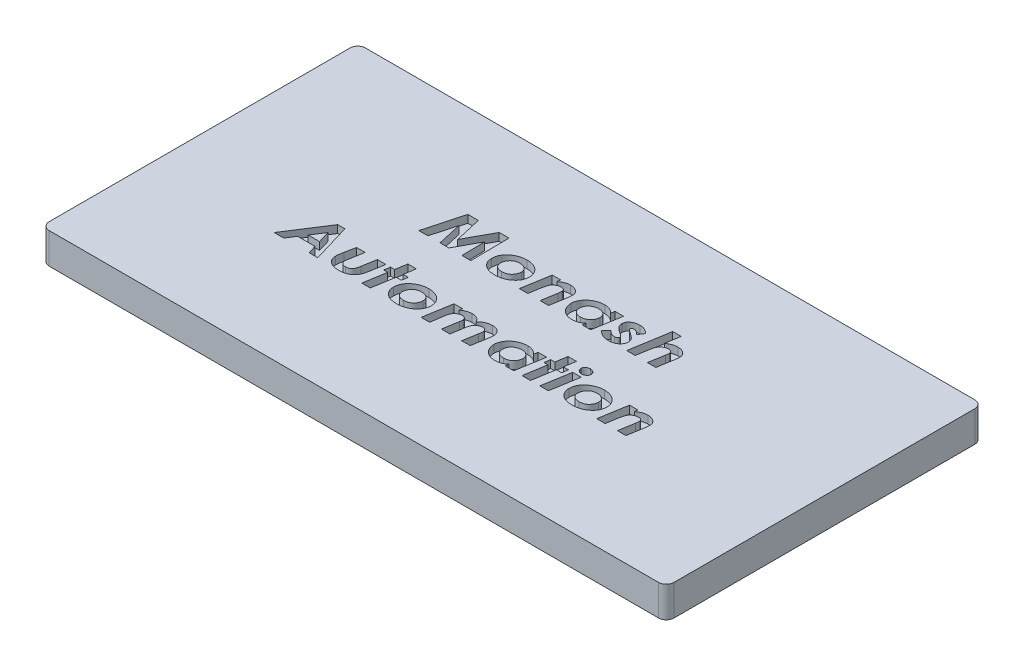
from build123d import *

# Parameters (mm, degrees)
BOSS_EXTRUDE4_DEPTH     = 4
SKETCH1_7_R             = 4.75
BOSS_EXTRUDE5_DEPTH     = 7
CUT_EXTRUDE2_DEPTH      = 47.706530593
CUT_EXTRUDE2_DEPTH_BACK = 1


with BuildPart() as part:
    # Sketch1 → Boss-Extrude4 (new body)
    with BuildSketch(Plane(origin=(0, 0, 0), x_dir=(1, 0, 0), z_dir=(0, 1, 0))):
        with BuildLine():
            Line((-39.5, 20.5), (39.5, 20.5))
            ThreePointArc((39.5, 20.5), (40.207106781, 20.207106781), (40.5, 19.5))
            Line((40.5, 19.5), (40.5, -19.5))
            ThreePointArc((40.5, -19.5), (40.207106781, -20.207106781), (39.5, -20.5))
            Line((39.5, -20.5), (-39.5, -20.5))
            ThreePointArc((-39.5, -20.5), (-40.207106781, -20.207106781), (-40.5, -19.5))
            Line((-40.5, -19.5), (-40.5, 19.5))
            ThreePointArc((-40.5, 19.5), (-40.207106781, 20.207106781), (-39.5, 20.5))
        make_face()
    extrude(amount=BOSS_EXTRUDE4_DEPTH)

    # Sketch1<7> → Boss-Extrude5 (add)
    with BuildSketch(Plane(origin=(0, 0, 0), x_dir=(1, 0, 0), z_dir=(0, 1, 0))):
        with Locations(Location((20, 0, 0), (0, 0, 270))):
            Circle(SKETCH1_7_R)
        with Locations(Location((-20, 0, 0), (0, 0, 270))):
            Circle(SKETCH1_7_R)
    extrude(amount=-BOSS_EXTRUDE5_DEPTH)

    # Sketch3 → Cut-Extrude2 (cut, two sides: drawn at the far end of the back side and taken through both)
    # profile 1 of 17: a face of its own
    with BuildSketch(Plane(origin=(0, 4, 0), x_dir=(1, 0, 0), z_dir=(0, 1, 0)).offset(-CUT_EXTRUDE2_DEPTH_BACK)):
        Polygon((-14.177109005, 8.458452894), (-12.817934325, 8.458452894), (-12.0266683, 4.974879176), (-10.123623428, 8.458452894), (-8.853591377, 8.458452894), (-8.789488813, 3.458452894), (-9.943334967, 3.458452894), (-10.007437531, 6.44923815), (-11.641051313, 3.458452894), (-12.786884646, 3.458452894), (-13.501027274, 6.599478535), (-14.359400672, 3.458452894), (-15.543294902, 3.458452894), align=None)
    # profile 2 of 17: a face of its own
    with BuildSketch(Plane(origin=(0, 4, 0), x_dir=(1, 0, 0), z_dir=(0, 1, 0)).offset(-CUT_EXTRUDE2_DEPTH_BACK)):
        with BuildLine():
            add(Edge.make_bspline(
                [(-5.205754838, 7.176401612), (-5.157986098, 7.176018128), (-5.063316945, 7.17525813), (-4.923322874, 7.16332593), (-4.78621551, 7.146636434), (-4.65271204, 7.122898828), (-4.522402446, 7.091372536), (-4.395528676, 7.053683234), (-4.271855087, 7.008314154), (-4.152139884, 6.956456877), (-4.036973296, 6.898493674), (-3.927571207, 6.83472), (-3.825514342, 6.763880535), (-3.728361564, 6.689618755), (-3.64064331, 6.606092236), (-3.557227843, 6.519583619), (-3.480298441, 6.426915495), (-3.411945471, 6.327821232), (-3.349774102, 6.224934599), (-3.295347966, 6.118713643), (-3.250119236, 6.008733288), (-3.213316888, 5.895819618), (-3.183938737, 5.779744274), (-3.162945244, 5.660942969), (-3.150726045, 5.538706369), (-3.149224505, 5.456343531), (-3.148463172, 5.414582702)],
                knots=[0, 0, 0, 0, 1.134040959, 2.247467629, 3.334150329, 4.413490396, 5.465399373, 6.516441462, 7.554877751, 8.591799532, 9.612991186, 10.61516897, 11.596012274, 12.561904645, 13.515581853, 14.468929422, 15.41506233, 16.371832588, 17.325015295, 18.268220228, 19.203191498, 20.145929778, 21.086264472, 22.044347893, 23.008416226, 24, 24, 24, 24], degree=3))
            add(Edge.make_bspline(
                [(-3.148463172, 5.414582702), (-3.150445347, 5.345662756), (-3.154357854, 5.209625428), (-3.189558634, 5.009806446), (-3.246942559, 4.818291916), (-3.326772942, 4.634259065), (-3.429801753, 4.458467621), (-3.554952303, 4.290109708), (-3.703398092, 4.130370092), (-3.872698846, 3.980903931), (-4.057683839, 3.843345635), (-4.255579612, 3.72243254), (-4.464907145, 3.62145495), (-4.68417098, 3.537550503), (-4.914702692, 3.473731032), (-5.155892025, 3.428015442), (-5.407706217, 3.39904262), (-5.579272891, 3.395931782), (-5.666492018, 3.39435033)],
                knots=[0, 0, 0, 0, 0.921708593, 1.819310388, 2.705598621, 3.592067026, 4.497077488, 5.426421462, 6.393915395, 7.409830938, 8.444621641, 9.475246663, 10.508347989, 11.550568148, 12.612935005, 13.704761146, 14.833172412, 16, 16, 16, 16], degree=3))
            add(Edge.make_bspline(
                [(-5.666492018, 3.39435033), (-5.742008556, 3.395515777), (-5.88937432, 3.397790074), (-6.104549371, 3.420766202), (-6.308099914, 3.455710132), (-6.499653519, 3.507313913), (-6.679671155, 3.572463457), (-6.848693218, 3.651070083), (-7.00519738, 3.746245581), (-7.148575933, 3.854914525), (-7.278445823, 3.974838416), (-7.390639018, 4.105676623), (-7.487548062, 4.24455362), (-7.564048705, 4.394066248), (-7.626311724, 4.551042103), (-7.669135772, 4.717578568), (-7.694315306, 4.892976397), (-7.697910435, 5.012856522), (-7.699745223, 5.07403783)],
                knots=[0, 0, 0, 0, 1.221687571, 2.384046269, 3.497990645, 4.560920458, 5.589868212, 6.592941434, 7.572395069, 8.548205602, 9.500149484, 10.427282185, 11.332508072, 12.233920424, 13.13895279, 14.060241795, 15.010036539, 16, 16, 16, 16], degree=3))
            add(Edge.make_bspline(
                [(-7.699745223, 5.07403783), (-7.697444506, 5.147968073), (-7.692910182, 5.293672096), (-7.656739335, 5.50706462), (-7.599063438, 5.711137909), (-7.51568764, 5.904828959), (-7.41003405, 6.089140329), (-7.280392606, 6.263704575), (-7.127257476, 6.428210274), (-6.95275739, 6.580986095), (-6.762996452, 6.719168589), (-6.564449138, 6.843199758), (-6.355797052, 6.944348821), (-6.141508121, 7.030836879), (-5.918200272, 7.095702095), (-5.687789405, 7.142688015), (-5.449214184, 7.171615688), (-5.287633452, 7.174792042), (-5.205754838, 7.176401612)],
                knots=[0, 0, 0, 0, 0.978943118, 1.929331537, 2.858896548, 3.782338015, 4.715536902, 5.667406287, 6.656439562, 7.687513275, 8.73496442, 9.763635104, 10.784334695, 11.802808489, 12.821714391, 13.86004861, 14.91561172, 16, 16, 16, 16], degree=3))
        make_face()
        with BuildLine():
            add(Edge.make_bspline(
                [(-5.287886249, 6.343068279), (-5.339692244, 6.341997786), (-5.440297355, 6.339918933), (-5.586804876, 6.321406899), (-5.724058353, 6.29178109), (-5.852502675, 6.250182324), (-5.970318986, 6.193801023), (-6.080679438, 6.128398545), (-6.180031122, 6.048137709), (-6.269578234, 5.958167556), (-6.349206942, 5.86151468), (-6.417958714, 5.761106711), (-6.478216695, 5.659648028), (-6.526050106, 5.555436556), (-6.563615253, 5.449144315), (-6.590582389, 5.341207412), (-6.607429066, 5.23081963), (-6.609139127, 5.156562928), (-6.610001633, 5.119109945)],
                knots=[0, 0, 0, 0, 1.235027415, 2.398372422, 3.515006561, 4.580035338, 5.609377971, 6.623926106, 7.632363676, 8.645755203, 9.646842525, 10.614179195, 11.545489814, 12.45747268, 13.343864026, 14.230219613, 15.107372783, 16, 16, 16, 16], degree=3))
            add(Edge.make_bspline(
                [(-6.610001633, 5.119109945), (-6.609343893, 5.086345414), (-6.608056425, 5.022211825), (-6.594690001, 4.928547108), (-6.572823003, 4.839829261), (-6.541530444, 4.756295459), (-6.501877917, 4.677675988), (-6.455418359, 4.602608018), (-6.396859748, 4.534841379), (-6.332580769, 4.470215304), (-6.259104475, 4.413993057), (-6.180848145, 4.363154212), (-6.096124249, 4.320994828), (-6.005332996, 4.28714736), (-5.909243235, 4.260001302), (-5.80734147, 4.241040319), (-5.699785353, 4.230114387), (-5.626119342, 4.228507275), (-5.588367018, 4.227683663)],
                knots=[0, 0, 0, 0, 1.029298631, 2.014758417, 2.966679621, 3.896477792, 4.81165136, 5.731625872, 6.662785172, 7.620070979, 8.592027595, 9.564324076, 10.549895611, 11.559533249, 12.606074263, 13.684591128, 14.813400324, 16, 16, 16, 16], degree=3))
            add(Edge.make_bspline(
                [(-5.588367018, 4.227683663), (-5.534903178, 4.228859997), (-5.431031548, 4.231145424), (-5.280163902, 4.24814814), (-5.139205633, 4.276874491), (-5.007923949, 4.318100059), (-4.886560808, 4.370956837), (-4.774922256, 4.435762404), (-4.673370936, 4.512085901), (-4.582408076, 4.599565168), (-4.50231183, 4.694303722), (-4.431212125, 4.792721526), (-4.372424009, 4.895485053), (-4.322435613, 5.000522987), (-4.285672409, 5.109686382), (-4.258562247, 5.221583678), (-4.240508874, 5.336875213), (-4.238978173, 5.415182868), (-4.238206761, 5.454646804)],
                knots=[0, 0, 0, 0, 1.253478669, 2.435307147, 3.554597822, 4.621750008, 5.655914285, 6.652227064, 7.641780917, 8.627393977, 9.60476431, 10.547599345, 11.470095912, 12.377216738, 13.270962539, 14.165291042, 15.07537985, 16, 16, 16, 16], degree=3))
            add(Edge.make_bspline(
                [(-4.238206761, 5.454646804), (-4.239327082, 5.486733321), (-4.241530242, 5.549832852), (-4.254183852, 5.642365678), (-4.277485415, 5.729985146), (-4.309839804, 5.812932868), (-4.351008825, 5.891296721), (-4.401327754, 5.96530968), (-4.462347932, 6.033055948), (-4.530102282, 6.097463009), (-4.605788939, 6.155031575), (-4.687587905, 6.205074693), (-4.773837012, 6.249062701), (-4.866696862, 6.28239362), (-4.964422678, 6.309624253), (-5.06747924, 6.329942835), (-5.176150582, 6.340528276), (-5.25013893, 6.342210197), (-5.287886249, 6.343068279)],
                knots=[0, 0, 0, 0, 0.998761082, 1.964107071, 2.899062725, 3.813590567, 4.72912115, 5.648416942, 6.590618194, 7.560816179, 8.55410426, 9.543090367, 10.542067585, 11.561103902, 12.607216108, 13.697340511, 14.825230961, 16, 16, 16, 16], degree=3))
        make_face(mode=Mode.SUBTRACT)
    # profile 3 of 17: a face of its own
    with BuildSketch(Plane(origin=(0, 4, 0), x_dir=(1, 0, 0), z_dir=(0, 1, 0)).offset(-CUT_EXTRUDE2_DEPTH_BACK)):
        with BuildLine():
            Line((-1.894456761, 7.112299048), (-0.792693941, 7.112299048))
            Line((-0.792693941, 7.112299048), (-0.861804518, 6.697635586))
            add(Edge.make_bspline(
                [(-0.861804518, 6.697635586), (-0.810914897, 6.735775658), (-0.711158973, 6.810539392), (-0.555126432, 6.908084263), (-0.3974738, 6.990175435), (-0.2392552, 7.059161655), (-0.078886859, 7.111617768), (0.083102954, 7.148298546), (0.24655151, 7.172880146), (0.356390558, 7.175228898), (0.411232341, 7.176401612)],
                knots=[0, 0, 0, 0, 1.100972132, 2.158170771, 3.182266255, 4.17680162, 5.144021205, 6.099154961, 7.050922844, 8, 8, 8, 8], degree=3))
            add(Edge.make_bspline(
                [(0.411232341, 7.176401612), (0.457331102, 7.175296385), (0.54737639, 7.173137531), (0.679429215, 7.160461934), (0.804949332, 7.137174693), (0.924354668, 7.105462228), (1.037235354, 7.064041704), (1.144224798, 7.01408093), (1.244059168, 6.953644793), (1.337304698, 6.886030803), (1.420994922, 6.810742656), (1.496069998, 6.731453233), (1.556861432, 6.644879959), (1.609302511, 6.555773348), (1.647796879, 6.460316049), (1.677942096, 6.361017893), (1.693295051, 6.256067746), (1.695946185, 6.18485488), (1.697290033, 6.148757381)],
                knots=[0, 0, 0, 0, 1.203755481, 2.35131072, 3.459245913, 4.533437425, 5.573119259, 6.594774717, 7.611359893, 8.615649263, 9.597286602, 10.547255557, 11.459270681, 12.353447624, 13.240585878, 14.139847265, 15.057096497, 16, 16, 16, 16], degree=3))
            add(Edge.make_bspline(
                [(1.697290033, 6.148757381), (1.696434642, 6.109666844), (1.694537351, 6.022962507), (1.67966314, 5.880078221), (1.659236165, 5.711307788), (1.63966227, 5.590467041), (1.629181059, 5.525760586)],
                knots=[0, 0, 0, 0, 0.747720737, 1.658473791, 2.74618569, 4, 4, 4, 4], degree=3))
            Line((1.629181059, 5.525760586), (1.28563138, 3.458452894))
            Line((1.28563138, 3.458452894), (0.184870162, 3.458452894))
            Line((0.184870162, 3.458452894), (0.519405418, 5.469670843))
            add(Edge.make_bspline(
                [(0.519405418, 5.469670843), (0.526688056, 5.51537277), (0.540272937, 5.600624185), (0.555199824, 5.719532429), (0.56523155, 5.820063129), (0.566784123, 5.880978233), (0.567482341, 5.908372766)],
                knots=[0, 0, 0, 0, 1.257141772, 2.345045846, 3.255739651, 4, 4, 4, 4], degree=3))
            add(Edge.make_bspline(
                [(0.567482341, 5.908372766), (0.565968507, 5.941300535), (0.563048787, 6.00480804), (0.534457295, 6.094241543), (0.485712839, 6.170678462), (0.418833263, 6.233940444), (0.334911524, 6.282731103), (0.236119307, 6.319168671), (0.121257053, 6.339558892), (0.039718678, 6.341853814), (-0.00343112, 6.343068279)],
                knots=[0, 0, 0, 0, 0.971478636, 1.873682499, 2.739059557, 3.625793431, 4.568767778, 5.590122915, 6.724702201, 8, 8, 8, 8], degree=3))
            add(Edge.make_bspline(
                [(-0.00343112, 6.343068279), (-0.04796374, 6.340938443), (-0.137550385, 6.336653834), (-0.272082814, 6.307676429), (-0.405279341, 6.257230598), (-0.537235559, 6.191181474), (-0.662270638, 6.108426448), (-0.772077197, 6.006832541), (-0.867184769, 5.891387992), (-0.934835586, 5.78231228), (-0.980331279, 5.681329259), (-1.016019399, 5.590795249), (-1.047911971, 5.484198197), (-1.080745378, 5.363256094), (-1.114483967, 5.227604704), (-1.144260162, 5.076567845), (-1.176101612, 4.910819923), (-1.194661231, 4.794982131), (-1.204352595, 4.734494561)],
                knots=[0, 0, 0, 0, 0.962270266, 1.935807175, 2.958420076, 4.032860869, 5.119417579, 6.186639856, 7.252666502, 8.344027149, 8.947699573, 9.644399427, 10.445366684, 11.35023558, 12.352904176, 13.465052712, 14.676314517, 16, 16, 16, 16], degree=3))
            Line((-1.204352595, 4.734494561), (-1.406676313, 3.458452894))
            Line((-1.406676313, 3.458452894), (-2.507437531, 3.458452894))
            Line((-2.507437531, 3.458452894), (-1.894456761, 7.112299048))
        make_face()
    # profile 4 of 17: a face of its own
    with BuildSketch(Plane(origin=(0, 4, 0), x_dir=(1, 0, 0), z_dir=(0, 1, 0)).offset(-CUT_EXTRUDE2_DEPTH_BACK)):
        with BuildLine():
            Line((6.24656888, 7.112299048), (7.347330098, 7.112299048))
            Line((7.347330098, 7.112299048), (6.734349328, 3.458452894))
            Line((6.734349328, 3.458452894), (5.63358811, 3.458452894))
            Line((5.63358811, 3.458452894), (5.7077067, 3.89815642))
            add(Edge.make_bspline(
                [(5.7077067, 3.89815642), (5.65126365, 3.853860524), (5.543002633, 3.768898449), (5.376433581, 3.660506777), (5.216818703, 3.571044637), (5.05914233, 3.503667241), (4.900279794, 3.452900054), (4.734234184, 3.420045411), (4.559457865, 3.398035556), (4.439749042, 3.395596593), (4.378580098, 3.39435033)],
                knots=[0, 0, 0, 0, 1.1838372, 2.27066783, 3.277037016, 4.200426999, 5.096336613, 6.024794754, 6.990707463, 8, 8, 8, 8], degree=3))
            add(Edge.make_bspline(
                [(4.378580098, 3.39435033), (4.308388442, 3.395735805), (4.170876188, 3.398450085), (3.970438123, 3.424151534), (3.780934865, 3.4649247), (3.60219393, 3.522082736), (3.434618383, 3.596249107), (3.277854103, 3.686942135), (3.133092597, 3.794913173), (3.000599595, 3.917589129), (2.882758935, 4.051614176), (2.777137387, 4.190545024), (2.690289576, 4.33697697), (2.617050985, 4.487260271), (2.562066287, 4.644094473), (2.521859859, 4.805646644), (2.497058844, 4.972778468), (2.49407143, 5.085973103), (2.492562469, 5.143148407)],
                knots=[0, 0, 0, 0, 1.171538007, 2.295156476, 3.367835321, 4.404461368, 5.422742617, 6.421922657, 7.422035349, 8.431935036, 9.430990657, 10.398760737, 11.341430634, 12.26897908, 13.185844971, 14.110658741, 15.045682155, 16, 16, 16, 16], degree=3))
            add(Edge.make_bspline(
                [(2.492562469, 5.143148407), (2.493530914, 5.187259215), (2.495458771, 5.275069378), (2.510853726, 5.406104413), (2.536941627, 5.535336866), (2.573637874, 5.662943183), (2.618233283, 5.789594994), (2.674626167, 5.914188565), (2.74259817, 6.036226706), (2.817966567, 6.157210241), (2.902718109, 6.273615216), (2.995268042, 6.384517217), (3.095391017, 6.488179128), (3.201741689, 6.58597738), (3.315598745, 6.676102023), (3.435682549, 6.760582524), (3.563546553, 6.837497941), (3.697014439, 6.908676383), (3.835611912, 6.970802066), (3.975731479, 7.026421088), (4.117978907, 7.072599151), (4.261387757, 7.110597779), (4.406917995, 7.139853542), (4.553737192, 7.160532062), (4.70216684, 7.17437505), (4.801559426, 7.17572536), (4.851336508, 7.176401612)],
                knots=[0, 0, 0, 0, 0.921899727, 1.835200247, 2.753606313, 3.674871814, 4.608635674, 5.55820152, 6.529598735, 7.526826541, 8.536118856, 9.536930185, 10.543855024, 11.546635474, 12.554841374, 13.577128273, 14.61365733, 15.672018767, 16.737101047, 17.786867546, 18.821962382, 19.861353942, 20.886519355, 21.922860431, 22.959741861, 24, 24, 24, 24], degree=3))
            add(Edge.make_bspline(
                [(4.851336508, 7.176401612), (4.917551737, 7.174830985), (5.047926841, 7.171738486), (5.239130217, 7.142454756), (5.422694864, 7.096956123), (5.596741832, 7.031441205), (5.760533264, 6.950215711), (5.90975425, 6.849712663), (6.045996923, 6.734046003), (6.122245818, 6.643047257), (6.160431059, 6.59747533)],
                knots=[0, 0, 0, 0, 1.071895657, 2.110519144, 3.125731938, 4.13024358, 5.117012808, 6.079961198, 7.038449743, 8, 8, 8, 8], degree=3))
            Line((6.160431059, 6.59747533), (6.24656888, 7.112299048))
        make_face()
        with BuildLine():
            add(Edge.make_bspline(
                [(4.627979136, 4.227683663), (4.689852745, 4.229291103), (4.810217793, 4.232418116), (4.984223404, 4.260155803), (5.146152132, 4.303899046), (5.296428594, 4.365978154), (5.433809313, 4.449536212), (5.560714439, 4.551710666), (5.675130858, 4.675169982), (5.775650417, 4.815716017), (5.85900822, 4.966952128), (5.921302617, 5.123061918), (5.958977805, 5.281923154), (5.963752423, 5.388683436), (5.966120162, 5.441625971)],
                knots=[0, 0, 0, 0, 1.106510134, 2.152535616, 3.143871394, 4.102481724, 5.051212295, 6.011273515, 7.008782323, 8.053271313, 9.095999097, 10.091107847, 11.053378391, 12, 12, 12, 12], degree=3))
            add(Edge.make_bspline(
                [(5.966120162, 5.441625971), (5.965002845, 5.474710502), (5.962815907, 5.53946725), (5.950242431, 5.634368634), (5.926506507, 5.723683532), (5.89603294, 5.808906498), (5.853983286, 5.88841115), (5.80428188, 5.963787985), (5.744356095, 6.033373893), (5.676186626, 6.097003625), (5.60133169, 6.155666361), (5.518660809, 6.205019193), (5.431725674, 6.248828924), (5.338075407, 6.282778472), (5.238861693, 6.309555858), (5.133835068, 6.329957131), (5.022830066, 6.340555686), (4.947176224, 6.342217256), (4.908427854, 6.343068279)],
                knots=[0, 0, 0, 0, 1.016096246, 1.988817321, 2.931086143, 3.848895347, 4.761250409, 5.685221007, 6.615820415, 7.573024866, 8.544881396, 9.52935962, 10.52413679, 11.529525498, 12.581392067, 13.67704895, 14.810231397, 16, 16, 16, 16], degree=3))
            add(Edge.make_bspline(
                [(4.908427854, 6.343068279), (4.862966637, 6.342250941), (4.773751512, 6.340646961), (4.642829905, 6.323726755), (4.516948808, 6.298275715), (4.396449007, 6.260700336), (4.280494753, 6.213775025), (4.170308265, 6.155413828), (4.065249489, 6.086819235), (3.967053719, 6.008287204), (3.876968396, 5.921871979), (3.798547995, 5.827872681), (3.730284282, 5.728646992), (3.676672655, 5.621791144), (3.633770358, 5.5094816), (3.604271962, 5.391098007), (3.585498209, 5.266611084), (3.583386234, 5.181612935), (3.582306059, 5.138140394)],
                knots=[0, 0, 0, 0, 1.088862099, 2.136831698, 3.158353851, 4.163068518, 5.157053707, 6.152004462, 7.14618284, 8.159557222, 9.161081095, 10.132230973, 11.088668878, 12.040477371, 12.99003011, 13.964174578, 14.958771402, 16, 16, 16, 16], degree=3))
            add(Edge.make_bspline(
                [(3.582306059, 5.138140394), (3.583415355, 5.104719171), (3.585586976, 5.039291876), (3.59827823, 4.943441672), (3.621613429, 4.852854237), (3.653685911, 4.767117922), (3.69509701, 4.686521756), (3.74538513, 4.610519566), (3.806143592, 4.540828042), (3.873868048, 4.475233747), (3.950235815, 4.417945953), (4.031317272, 4.366382415), (4.117965151, 4.323253736), (4.20981169, 4.287920251), (4.307132207, 4.26099039), (4.40975182, 4.242442232), (4.517156195, 4.229789218), (4.590548233, 4.228394823), (4.627979136, 4.227683663)],
                knots=[0, 0, 0, 0, 1.030104972, 2.016592372, 2.972287841, 3.906703149, 4.83155431, 5.758919901, 6.707444843, 7.675246564, 8.658832682, 9.643601836, 10.632821522, 11.635907588, 12.671801871, 13.739248843, 14.846987243, 16, 16, 16, 16], degree=3))
        make_face(mode=Mode.SUBTRACT)
    # profile 5 of 17: a face of its own
    with BuildSketch(Plane(origin=(0, 4, 0), x_dir=(1, 0, 0), z_dir=(0, 1, 0)).offset(-CUT_EXTRUDE2_DEPTH_BACK)):
        with BuildLine():
            Line((10.712714713, 6.570432061), (10.239958303, 5.883332702))
            add(Edge.make_bspline(
                [(10.239958303, 5.883332702), (10.209457693, 5.920530516), (10.150658622, 5.992240456), (10.056309261, 6.088802334), (9.958156147, 6.168025087), (9.858515624, 6.231189663), (9.760275613, 6.280927578), (9.664117584, 6.315980344), (9.570940358, 6.338745804), (9.509574299, 6.341654333), (9.479741957, 6.343068279)],
                knots=[0, 0, 0, 0, 1.257620827, 2.424441246, 3.523440145, 4.547954636, 5.504558691, 6.396676447, 7.220564295, 8, 8, 8, 8], degree=3))
            add(Edge.make_bspline(
                [(9.479741957, 6.343068279), (9.458325097, 6.342303659), (9.416472177, 6.340809435), (9.356094801, 6.329060394), (9.300991403, 6.307635158), (9.253029336, 6.278627931), (9.211486568, 6.24680751), (9.181906562, 6.210379046), (9.162823016, 6.171484462), (9.160424426, 6.144283565), (9.159229136, 6.130728535)],
                knots=[0, 0, 0, 0, 1.220798908, 2.385690469, 3.488735518, 4.572722544, 5.574698877, 6.454774193, 7.229967193, 8, 8, 8, 8], degree=3))
            add(Edge.make_bspline(
                [(9.159229136, 6.130728535), (9.160379314, 6.117610758), (9.162732044, 6.090777886), (9.176689956, 6.050466318), (9.199857813, 6.010411732), (9.221199478, 5.986149155), (9.232346123, 5.973476932)],
                knots=[0, 0, 0, 0, 0.888479801, 1.817416598, 2.860047626, 4, 4, 4, 4], degree=3))
            add(Edge.make_bspline(
                [(9.232346123, 5.973476932), (9.239555947, 5.965985167), (9.256141636, 5.948750892), (9.287914307, 5.923469925), (9.326970587, 5.892013988), (9.374949036, 5.85608247), (9.432453716, 5.816252137), (9.498229527, 5.771006998), (9.573574659, 5.72243054), (9.626326059, 5.6880443), (9.654020803, 5.669991356)],
                knots=[0, 0, 0, 0, 0.479102557, 1.102141438, 1.869311591, 2.793247955, 3.865549427, 5.095634596, 6.475193941, 8, 8, 8, 8], degree=3))
            add(Edge.make_bspline(
                [(9.654020803, 5.669991356), (9.698923889, 5.64085998), (9.785474979, 5.584708999), (9.907802608, 5.49961936), (10.017744962, 5.417419286), (10.116866045, 5.339646827), (10.202569332, 5.263475915), (10.277363927, 5.1915139), (10.340023489, 5.12251591), (10.406099388, 5.035043281), (10.471744221, 4.925012718), (10.529015918, 4.787280253), (10.563182454, 4.643339464), (10.567376758, 4.545369795), (10.569485546, 4.49611315)],
                knots=[0, 0, 0, 0, 1.234934004, 2.380346026, 3.437244193, 4.402096807, 5.286200182, 6.081545611, 6.79612852, 7.433969755, 8.608439849, 9.741428408, 10.864447937, 12, 12, 12, 12], degree=3))
            add(Edge.make_bspline(
                [(10.569485546, 4.49611315), (10.568328022, 4.463310752), (10.566007402, 4.397548108), (10.547154283, 4.300015952), (10.517102007, 4.203642553), (10.472979427, 4.109573132), (10.41887926, 4.015440822), (10.351208913, 3.923852616), (10.272338469, 3.832954757), (10.182387612, 3.744535983), (10.080278698, 3.662235655), (9.966803857, 3.5895286), (9.841183027, 3.529931916), (9.705729335, 3.479151317), (9.558719606, 3.442249917), (9.40157652, 3.413464756), (9.233313436, 3.398199633), (9.117522077, 3.395656262), (9.058067277, 3.39435033)],
                knots=[0, 0, 0, 0, 0.758772865, 1.521197, 2.291104468, 3.089945819, 3.921032061, 4.800577857, 5.720969434, 6.70465792, 7.716066425, 8.751546603, 9.816120003, 10.928672579, 12.094567481, 13.319418004, 14.623615213, 16, 16, 16, 16], degree=3))
            add(Edge.make_bspline(
                [(9.058067277, 3.39435033), (8.988872775, 3.396033457), (8.853273622, 3.399331848), (8.654466192, 3.426687965), (8.465538682, 3.473345185), (8.313737236, 3.525728873), (8.195374833, 3.579654079), (8.104648966, 3.627871188), (8.010988053, 3.683231543), (7.915286292, 3.746375133), (7.816672906, 3.816801059), (7.715979424, 3.894889313), (7.612295836, 3.980249499), (7.543778757, 4.04115431), (7.50858811, 4.072435266)],
                knots=[0, 0, 0, 0, 1.433573786, 2.809347334, 4.148479658, 5.461438667, 6.130253693, 6.842098035, 7.58966388, 8.384137852, 9.217403547, 10.100348214, 11.024331229, 12, 12, 12, 12], degree=3))
            Line((7.50858811, 4.072435266), (8.126576892, 4.707451291))
            add(Edge.make_bspline(
                [(8.126576892, 4.707451291), (8.161410792, 4.669517365), (8.229187414, 4.595708994), (8.337357674, 4.496919231), (8.449141971, 4.41397922), (8.563938107, 4.346849609), (8.680217787, 4.292501529), (8.799964442, 4.255846696), (8.921499184, 4.231165878), (9.003860405, 4.228844504), (9.045046444, 4.227683663)],
                knots=[0, 0, 0, 0, 1.155283962, 2.247846097, 3.281733652, 4.272373144, 5.227827299, 6.154292611, 7.077024669, 8, 8, 8, 8], degree=3))
            add(Edge.make_bspline(
                [(9.045046444, 4.227683663), (9.076517014, 4.228433136), (9.136575422, 4.229863429), (9.221490225, 4.246356766), (9.297161177, 4.271736722), (9.361045472, 4.309136577), (9.413571942, 4.352447532), (9.451708219, 4.401213543), (9.476181738, 4.454595973), (9.478548924, 4.492190179), (9.479741957, 4.511137189)],
                knots=[0, 0, 0, 0, 1.314923524, 2.509398947, 3.605037461, 4.637689983, 5.589210412, 6.435793505, 7.211659488, 8, 8, 8, 8], degree=3))
            add(Edge.make_bspline(
                [(9.479741957, 4.511137189), (9.478785802, 4.526627175), (9.476803693, 4.558737931), (9.459210215, 4.606604775), (9.431881024, 4.654987551), (9.399311566, 4.694918847), (9.365726387, 4.730410994), (9.328941163, 4.760766988), (9.283960344, 4.796932254), (9.229712368, 4.837830365), (9.166433048, 4.884134385), (9.093624842, 4.934882555), (9.011039987, 4.990148703), (8.952615893, 5.028041522), (8.921849328, 5.047996163)],
                knots=[0, 0, 0, 0, 0.695573475, 1.441924511, 2.269811168, 3.190121864, 3.753594514, 4.467762631, 5.33406423, 6.353293601, 7.525934317, 8.864597354, 10.34887352, 12, 12, 12, 12], degree=3))
            add(Edge.make_bspline(
                [(8.921849328, 5.047996163), (8.885967523, 5.071467906), (8.816595592, 5.116846896), (8.718606001, 5.18641047), (8.628504961, 5.252148933), (8.546851132, 5.315038421), (8.474940934, 5.376535832), (8.410307498, 5.43413387), (8.355112883, 5.490324365), (8.32238875, 5.527946004), (8.306865354, 5.545792638)],
                knots=[0, 0, 0, 0, 1.296193094, 2.505989223, 3.632534563, 4.668328968, 5.620853868, 6.492677806, 7.284969275, 8, 8, 8, 8], degree=3))
            add(Edge.make_bspline(
                [(8.306865354, 5.545792638), (8.270407869, 5.593764958), (8.199904598, 5.686536182), (8.12525605, 5.840385882), (8.078389255, 5.998105743), (8.07244469, 6.105375577), (8.069485546, 6.158773407)],
                knots=[0, 0, 0, 0, 1.076556189, 2.081897146, 3.045187959, 4, 4, 4, 4], degree=3))
            add(Edge.make_bspline(
                [(8.069485546, 6.158773407), (8.070505669, 6.195589828), (8.072513891, 6.268066909), (8.092379683, 6.37364973), (8.123246739, 6.474181163), (8.168029917, 6.568854685), (8.2245712, 6.658602696), (8.293389524, 6.743411726), (8.37495498, 6.822870813), (8.468887461, 6.894761578), (8.570596111, 6.960332763), (8.677363988, 7.018814501), (8.789686233, 7.066765896), (8.905728047, 7.106988491), (9.026634351, 7.138286994), (9.151978969, 7.159611642), (9.281723297, 7.174779405), (9.369853893, 7.175855029), (9.41463779, 7.176401612)],
                knots=[0, 0, 0, 0, 0.941920652, 1.854272014, 2.741270807, 3.628681601, 4.527755086, 5.451810374, 6.419231231, 7.436849334, 8.475620088, 9.516254172, 10.550263538, 11.599398447, 12.659106609, 13.74430921, 14.853762164, 16, 16, 16, 16], degree=3))
            add(Edge.make_bspline(
                [(9.41463779, 7.176401612), (9.477843404, 7.174417032), (9.602925227, 7.170489614), (9.788233461, 7.140810032), (9.967954781, 7.090108981), (10.141723619, 7.021450569), (10.306177907, 6.934800746), (10.456938451, 6.829656055), (10.595066901, 6.709740719), (10.673451096, 6.616924739), (10.712714713, 6.570432061)],
                knots=[0, 0, 0, 0, 1.023628673, 2.025727356, 3.030900885, 4.043265708, 5.047332795, 6.034521133, 7.015467213, 8, 8, 8, 8], degree=3))
        make_face()
    # profile 6 of 17: a face of its own
    with BuildSketch(Plane(origin=(0, 4, 0), x_dir=(1, 0, 0), z_dir=(0, 1, 0)).offset(-CUT_EXTRUDE2_DEPTH_BACK)):
        with BuildLine():
            Line((12.252177854, 8.586658022), (13.351937469, 8.586658022))
            Line((13.351937469, 8.586658022), (13.038435867, 6.699638791))
            add(Edge.make_bspline(
                [(13.038435867, 6.699638791), (13.089233961, 6.737929378), (13.188896473, 6.813052985), (13.346321427, 6.908517199), (13.503684282, 6.991764517), (13.66354509, 7.059080188), (13.825054893, 7.111542212), (13.988042876, 7.148192249), (14.152127335, 7.172944284), (14.262304566, 7.175247926), (14.317482341, 7.176401612)],
                knots=[0, 0, 0, 0, 1.097224053, 2.15268125, 3.173290369, 4.16748368, 5.142370428, 6.099869179, 7.048396923, 8, 8, 8, 8], degree=3))
            add(Edge.make_bspline(
                [(14.317482341, 7.176401612), (14.363580861, 7.17528854), (14.453957889, 7.17310634), (14.58667101, 7.16044292), (14.712888816, 7.137295641), (14.832623808, 7.105490631), (14.945707631, 7.063794884), (15.053262766, 7.014347992), (15.153366705, 6.953682402), (15.246514692, 6.885630302), (15.331349091, 6.811492504), (15.405103159, 6.730725585), (15.467336139, 6.645277699), (15.519369462, 6.555685647), (15.558464095, 6.460528419), (15.586535324, 6.360718716), (15.603981249, 6.256201037), (15.606347753, 6.184882114), (15.607546444, 6.148757381)],
                knots=[0, 0, 0, 0, 1.201515699, 2.355594442, 3.470026529, 4.542219334, 5.579966672, 6.607597271, 7.622290926, 8.624711652, 9.611029869, 10.553344607, 11.468763105, 12.361276287, 13.246763876, 14.141945012, 15.058850922, 16, 16, 16, 16], degree=3))
            add(Edge.make_bspline(
                [(15.607546444, 6.148757381), (15.606691053, 6.109666844), (15.604793761, 6.022962507), (15.58991955, 5.880078221), (15.569492575, 5.711307788), (15.54991868, 5.590467041), (15.539437469, 5.525760586)],
                knots=[0, 0, 0, 0, 0.747720737, 1.658473791, 2.74618569, 4, 4, 4, 4], degree=3))
            Line((15.539437469, 5.525760586), (15.19588779, 3.458452894))
            Line((15.19588779, 3.458452894), (14.095126572, 3.458452894))
            Line((14.095126572, 3.458452894), (14.429661828, 5.469670843))
            add(Edge.make_bspline(
                [(14.429661828, 5.469670843), (14.436944467, 5.51537277), (14.450529347, 5.600624185), (14.465456235, 5.719532429), (14.47548796, 5.820063129), (14.477040533, 5.880978233), (14.477738751, 5.908372766)],
                knots=[0, 0, 0, 0, 1.257141772, 2.345045846, 3.255739651, 4, 4, 4, 4], degree=3))
            add(Edge.make_bspline(
                [(14.477738751, 5.908372766), (14.476249544, 5.941316122), (14.473377323, 6.00485369), (14.444508964, 6.093905771), (14.397119948, 6.170979132), (14.330009942, 6.233886887), (14.246195376, 6.282756038), (14.147672416, 6.319009111), (14.033535856, 6.339597189), (13.952650864, 6.34186676), (13.909830098, 6.343068279)],
                knots=[0, 0, 0, 0, 0.97450116, 1.879512016, 2.742313032, 3.631805767, 4.577713955, 5.602246795, 6.730621975, 8, 8, 8, 8], degree=3))
            add(Edge.make_bspline(
                [(13.909830098, 6.343068279), (13.865626881, 6.340935285), (13.776366033, 6.336628068), (13.642680885, 6.307558792), (13.509734693, 6.258514051), (13.379235642, 6.192064427), (13.25531138, 6.110109495), (13.144838756, 6.011240008), (13.051165554, 5.896048543), (12.983788682, 5.788216798), (12.937385675, 5.688354286), (12.904288032, 5.59788243), (12.869617785, 5.493666672), (12.838373179, 5.373606988), (12.80665969, 5.23895878), (12.774196704, 5.089889589), (12.744659616, 4.925690504), (12.725785296, 4.811308402), (12.715919841, 4.751521804)],
                knots=[0, 0, 0, 0, 0.963474025, 1.945571311, 2.967839669, 4.045233061, 5.131245347, 6.198065147, 7.263220233, 8.357977112, 8.960354518, 9.660575405, 10.456930463, 11.353803126, 12.363584777, 13.472762784, 14.679033579, 16, 16, 16, 16], degree=3))
            Line((12.715919841, 4.751521804), (12.502578495, 3.458452894))
            Line((12.502578495, 3.458452894), (11.40281888, 3.458452894))
            Line((11.40281888, 3.458452894), (12.252177854, 8.586658022))
        make_face()
    # profile 7 of 17: a face of its own
    with BuildSketch(Plane(origin=(0, 4, 0), x_dir=(1, 0, 0), z_dir=(0, 1, 0)).offset(-CUT_EXTRUDE2_DEPTH_BACK)):
        Polygon((-21.465770864, -1.131290696), (-20.532277274, -1.131290696), (-19.045899069, -6.131290696), (-20.169697146, -6.131290696), (-20.494216377, -5.041547106), (-22.743815736, -5.041547106), (-23.445939133, -6.131290696), (-24.68692471, -6.131290696), align=None)
        Polygon((-20.74161221, -4.208213773), (-21.204352595, -2.651723388), (-22.206956761, -4.208213773), align=None, mode=Mode.SUBTRACT)
    # profile 8 of 17: a face of its own
    with BuildSketch(Plane(origin=(0, 4, 0), x_dir=(1, 0, 0), z_dir=(0, 1, 0)).offset(-CUT_EXTRUDE2_DEPTH_BACK)):
        with BuildLine():
            Line((-17.674705159, -2.477444542), (-16.572942338, -2.477444542))
            Line((-16.572942338, -2.477444542), (-16.887445543, -4.332412491))
            add(Edge.make_bspline(
                [(-16.887445543, -4.332412491), (-16.894727892, -4.380453387), (-16.908310433, -4.470056004), (-16.923238509, -4.594970846), (-16.93330505, -4.700840231), (-16.934831812, -4.765087867), (-16.935522467, -4.794151273)],
                knots=[0, 0, 0, 0, 1.254897867, 2.340550264, 3.249322389, 4, 4, 4, 4], degree=3))
            add(Edge.make_bspline(
                [(-16.935522467, -4.794151273), (-16.933385174, -4.832855848), (-16.929172556, -4.909142801), (-16.890140031, -5.018263095), (-16.825729282, -5.116246338), (-16.739548043, -5.203182418), (-16.632889322, -5.274253336), (-16.509421189, -5.32542096), (-16.371538396, -5.357180442), (-16.274644431, -5.360393358), (-16.224384646, -5.362059927)],
                knots=[0, 0, 0, 0, 0.912926507, 1.799383726, 2.701698242, 3.667581673, 4.674915776, 5.711680415, 6.813027724, 8, 8, 8, 8], degree=3))
            add(Edge.make_bspline(
                [(-16.224384646, -5.362059927), (-16.191640635, -5.361576874), (-16.12765874, -5.360632989), (-16.034491051, -5.350564394), (-15.947110487, -5.333507193), (-15.865629141, -5.310545116), (-15.789878759, -5.281660425), (-15.720151527, -5.245547815), (-15.656955349, -5.201708884), (-15.596901151, -5.152337448), (-15.543180551, -5.090646611), (-15.494354246, -5.016474274), (-15.448059375, -4.929794194), (-15.40633434, -4.829041526), (-15.368977124, -4.71460617), (-15.333724738, -4.587039302), (-15.302922256, -4.445896946), (-15.286439803, -4.346849882), (-15.277870223, -4.295353196)],
                knots=[0, 0, 0, 0, 0.979567135, 1.914077113, 2.799724298, 3.640979673, 4.444362575, 5.221921877, 5.983986135, 6.742571379, 7.542405395, 8.420809753, 9.395217336, 10.478850387, 11.67942272, 12.995570123, 14.437932649, 16, 16, 16, 16], degree=3))
            Line((-15.277870223, -4.295353196), (-14.971379838, -2.477444542))
            Line((-14.971379838, -2.477444542), (-13.869617018, -2.477444542))
            Line((-13.869617018, -2.477444542), (-14.201147467, -4.438582362))
            add(Edge.make_bspline(
                [(-14.201147467, -4.438582362), (-14.210667752, -4.491767934), (-14.229250788, -4.595583028), (-14.264658571, -4.745488828), (-14.303361326, -4.886400341), (-14.347429885, -5.017833537), (-14.396286443, -5.140395436), (-14.450623602, -5.253551828), (-14.508078306, -5.358308165), (-14.592726348, -5.48354152), (-14.710808157, -5.625892103), (-14.875696606, -5.774086254), (-15.059845825, -5.903839654), (-15.230835263, -5.990936977), (-15.376397598, -6.050592309), (-15.491372831, -6.089789347), (-15.611400987, -6.121384089), (-15.735610303, -6.148758932), (-15.865035252, -6.169624151), (-15.999409749, -6.184514471), (-16.138451581, -6.19371574), (-16.232717155, -6.194829169), (-16.28047439, -6.19539326)],
                knots=[0, 0, 0, 0, 1.071724053, 2.091942034, 3.05454479, 3.969863704, 4.840676004, 5.670206056, 6.458935363, 7.208449198, 8.666259099, 10.115179233, 11.594364625, 13.122966968, 13.910165165, 14.714481664, 15.530682924, 16.371245843, 17.236929505, 18.130026743, 19.052626026, 20, 20, 20, 20], degree=3))
            add(Edge.make_bspline(
                [(-16.28047439, -6.19539326), (-16.347291628, -6.194308924), (-16.477508348, -6.192195717), (-16.667603045, -6.173756307), (-16.847139255, -6.144226391), (-17.016323623, -6.102075451), (-17.175039632, -6.048291764), (-17.323235784, -5.981809229), (-17.46100113, -5.903701549), (-17.587308331, -5.813785541), (-17.69971582, -5.713430561), (-17.800553815, -5.607578502), (-17.883529109, -5.492442664), (-17.95295528, -5.3712287), (-18.005733712, -5.242460637), (-18.044549693, -5.106880137), (-18.066319651, -4.964125059), (-18.069649207, -4.866670326), (-18.071339774, -4.817188132)],
                knots=[0, 0, 0, 0, 1.265480231, 2.466230077, 3.614115165, 4.709341243, 5.765371616, 6.784488949, 7.781544682, 8.760850624, 9.715188154, 10.632510406, 11.524362471, 12.396692742, 13.272889126, 14.153797807, 15.062599276, 16, 16, 16, 16], degree=3))
            add(Edge.make_bspline(
                [(-18.071339774, -4.817188132), (-18.070825234, -4.784800218), (-18.0697638, -4.717987833), (-18.065081498, -4.614358031), (-18.054373972, -4.504572538), (-18.041256736, -4.388057177), (-18.025779797, -4.264650588), (-18.003971096, -4.134968908), (-17.980354213, -3.998266817), (-17.961717442, -3.905355049), (-17.952149069, -3.857652875)],
                knots=[0, 0, 0, 0, 0.802768607, 1.65601543, 2.569931401, 3.535747871, 4.562049697, 5.65164048, 6.794320071, 8, 8, 8, 8], degree=3))
            Line((-17.952149069, -3.857652875), (-17.674705159, -2.477444542))
        make_face()
    # profile 9 of 17: a face of its own
    with BuildSketch(Plane(origin=(0, 4, 0), x_dir=(1, 0, 0), z_dir=(0, 1, 0)).offset(-CUT_EXTRUDE2_DEPTH_BACK)):
        Polygon((-12.500426313, -1.003085568), (-11.400666697, -1.003085568), (-11.642052915, -2.477444542), (-10.964969582, -2.477444542), (-11.09317471, -3.246675311), (-11.768254838, -3.246675311), (-12.241011249, -6.131290696), (-13.340770864, -6.131290696), (-12.868014454, -3.246675311), (-13.392854197, -3.246675311), (-13.268655479, -2.477444542), (-12.741812531, -2.477444542), align=None)
    # profile 10 of 17: a face of its own
    with BuildSketch(Plane(origin=(0, 4, 0), x_dir=(1, 0, 0), z_dir=(0, 1, 0)).offset(-CUT_EXTRUDE2_DEPTH_BACK)):
        with BuildLine():
            add(Edge.make_bspline(
                [(-8.346780479, -2.413341978), (-8.299011739, -2.413725462), (-8.204342586, -2.41448546), (-8.064348515, -2.42641766), (-7.927241151, -2.443107156), (-7.793737681, -2.466844762), (-7.663428087, -2.498371054), (-7.536554317, -2.536060356), (-7.412880728, -2.581429435), (-7.293165525, -2.633286713), (-7.177998937, -2.691249916), (-7.068596848, -2.755023589), (-6.966539983, -2.825863055), (-6.869387205, -2.900124835), (-6.781668952, -2.983651354), (-6.698253484, -3.07015997), (-6.621324082, -3.162828095), (-6.552971112, -3.261922358), (-6.490799743, -3.36480899), (-6.436373607, -3.471029947), (-6.391144877, -3.581010302), (-6.354342529, -3.693923972), (-6.324964378, -3.809999316), (-6.303970885, -3.92880062), (-6.291751686, -4.051037221), (-6.290250146, -4.133400059), (-6.289488813, -4.175160888)],
                knots=[0, 0, 0, 0, 1.134040959, 2.247467629, 3.334150329, 4.413490396, 5.465399373, 6.516441462, 7.554877751, 8.591799532, 9.612991186, 10.61516897, 11.596012274, 12.561904645, 13.515581853, 14.468929422, 15.41506233, 16.371832588, 17.325015295, 18.268220228, 19.203191498, 20.145929778, 21.086264472, 22.044347893, 23.008416226, 24, 24, 24, 24], degree=3))
            add(Edge.make_bspline(
                [(-6.289488813, -4.175160888), (-6.291470988, -4.244080834), (-6.295383495, -4.380118162), (-6.330584275, -4.579937144), (-6.3879682, -4.771451674), (-6.467798583, -4.955484524), (-6.570827395, -5.131275969), (-6.695977944, -5.299633882), (-6.844423733, -5.459373498), (-7.013724487, -5.608839659), (-7.19870948, -5.746397955), (-7.396605253, -5.867311049), (-7.605932786, -5.968288639), (-7.825196621, -6.052193087), (-8.055728333, -6.116012558), (-8.296917666, -6.161728148), (-8.548731858, -6.19070097), (-8.720298532, -6.193811807), (-8.807517659, -6.19539326)],
                knots=[0, 0, 0, 0, 0.921708593, 1.819310388, 2.705598621, 3.592067026, 4.497077488, 5.426421462, 6.393915395, 7.409830938, 8.444621641, 9.475246663, 10.508347989, 11.550568148, 12.612935005, 13.704761146, 14.833172412, 16, 16, 16, 16], degree=3))
            add(Edge.make_bspline(
                [(-8.807517659, -6.19539326), (-8.883034197, -6.194227813), (-9.030399961, -6.191953516), (-9.245575012, -6.168977388), (-9.449125555, -6.134033458), (-9.640679161, -6.082429677), (-9.820696796, -6.017280133), (-9.989718859, -5.938673507), (-10.146223021, -5.843498009), (-10.289601574, -5.734829064), (-10.419471464, -5.614905174), (-10.531664659, -5.484066966), (-10.628573703, -5.345189969), (-10.705074346, -5.195677341), (-10.767337365, -5.038701487), (-10.810161413, -4.872165022), (-10.835340947, -4.696767193), (-10.838936076, -4.576887068), (-10.840770864, -4.51570576)],
                knots=[0, 0, 0, 0, 1.221687571, 2.384046269, 3.497990645, 4.560920458, 5.589868212, 6.592941434, 7.572395069, 8.548205602, 9.500149484, 10.427282185, 11.332508072, 12.233920424, 13.13895279, 14.060241795, 15.010036539, 16, 16, 16, 16], degree=3))
            add(Edge.make_bspline(
                [(-10.840770864, -4.51570576), (-10.838470147, -4.441775516), (-10.833935823, -4.296071494), (-10.797764976, -4.08267897), (-10.740089079, -3.878605681), (-10.656713281, -3.684914631), (-10.551059691, -3.500603261), (-10.421418247, -3.326039015), (-10.268283117, -3.161533316), (-10.093783031, -3.008757495), (-9.904022093, -2.870575001), (-9.705474779, -2.746543831), (-9.496822693, -2.645394769), (-9.282533762, -2.558906711), (-9.059225913, -2.494041495), (-8.828815046, -2.447055575), (-8.590239825, -2.418127902), (-8.428659093, -2.414951548), (-8.346780479, -2.413341978)],
                knots=[0, 0, 0, 0, 0.978943118, 1.929331537, 2.858896548, 3.782338015, 4.715536902, 5.667406287, 6.656439562, 7.687513275, 8.73496442, 9.763635104, 10.784334695, 11.802808489, 12.821714391, 13.86004861, 14.91561172, 16, 16, 16, 16], degree=3))
        make_face()
        with BuildLine():
            add(Edge.make_bspline(
                [(-8.42891189, -3.246675311), (-8.480717885, -3.247745804), (-8.581322996, -3.249824657), (-8.727830517, -3.26833669), (-8.865083994, -3.2979625), (-8.993528316, -3.339561265), (-9.111344627, -3.395942567), (-9.221705079, -3.461345045), (-9.321056763, -3.541605881), (-9.410603875, -3.631576034), (-9.490232583, -3.72822891), (-9.558984355, -3.828636878), (-9.619242336, -3.930095562), (-9.667075747, -4.034307034), (-9.704640894, -4.140599275), (-9.73160803, -4.248536178), (-9.748454707, -4.35892396), (-9.750164768, -4.433180662), (-9.751027274, -4.470633644)],
                knots=[0, 0, 0, 0, 1.235027415, 2.398372422, 3.515006561, 4.580035338, 5.609377971, 6.623926106, 7.632363676, 8.645755203, 9.646842525, 10.614179195, 11.545489814, 12.45747268, 13.343864026, 14.230219613, 15.107372783, 16, 16, 16, 16], degree=3))
            add(Edge.make_bspline(
                [(-9.751027274, -4.470633644), (-9.750369534, -4.503398176), (-9.749082066, -4.567531764), (-9.735715642, -4.661196481), (-9.713848644, -4.749914329), (-9.682556085, -4.833448131), (-9.642903558, -4.912067602), (-9.596444, -4.987135572), (-9.537885389, -5.054902211), (-9.47360641, -5.119528286), (-9.400130116, -5.175750533), (-9.321873786, -5.226589378), (-9.23714989, -5.268748762), (-9.146358637, -5.302596229), (-9.050268876, -5.329742288), (-8.948367111, -5.348703271), (-8.840810994, -5.359629202), (-8.767144983, -5.361236314), (-8.729392659, -5.362059927)],
                knots=[0, 0, 0, 0, 1.029298631, 2.014758417, 2.966679621, 3.896477792, 4.81165136, 5.731625872, 6.662785172, 7.620070979, 8.592027595, 9.564324076, 10.549895611, 11.559533249, 12.606074263, 13.684591128, 14.813400324, 16, 16, 16, 16], degree=3))
            add(Edge.make_bspline(
                [(-8.729392659, -5.362059927), (-8.675928819, -5.360883593), (-8.572057189, -5.358598166), (-8.421189543, -5.34159545), (-8.280231274, -5.312869098), (-8.14894959, -5.271643531), (-8.027586449, -5.218786752), (-7.915947897, -5.153981185), (-7.814396577, -5.077657689), (-7.723433717, -4.990178422), (-7.643337471, -4.895439868), (-7.572237766, -4.797022064), (-7.51344965, -4.694258537), (-7.463461254, -4.589220603), (-7.42669805, -4.480057207), (-7.399587888, -4.368159911), (-7.381534515, -4.252868377), (-7.380003814, -4.174560721), (-7.379232402, -4.135096786)],
                knots=[0, 0, 0, 0, 1.253478669, 2.435307147, 3.554597822, 4.621750008, 5.655914285, 6.652227064, 7.641780917, 8.627393977, 9.60476431, 10.547599345, 11.470095912, 12.377216738, 13.270962539, 14.165291042, 15.07537985, 16, 16, 16, 16], degree=3))
            add(Edge.make_bspline(
                [(-7.379232402, -4.135096786), (-7.380352723, -4.103010268), (-7.382555883, -4.039910738), (-7.395209493, -3.947377911), (-7.418511056, -3.859758444), (-7.450865445, -3.776810721), (-7.492034466, -3.698446869), (-7.542353395, -3.62443391), (-7.603373573, -3.556687641), (-7.671127923, -3.49228058), (-7.74681458, -3.434712015), (-7.828613546, -3.384668897), (-7.914862653, -3.340680889), (-8.007722503, -3.30734997), (-8.105448319, -3.280119337), (-8.208504881, -3.259800754), (-8.317176223, -3.249215314), (-8.391164571, -3.247533393), (-8.42891189, -3.246675311)],
                knots=[0, 0, 0, 0, 0.998761082, 1.964107071, 2.899062725, 3.813590567, 4.72912115, 5.648416942, 6.590618194, 7.560816179, 8.55410426, 9.543090367, 10.542067585, 11.561103902, 12.607216108, 13.697340511, 14.825230961, 16, 16, 16, 16], degree=3))
        make_face(mode=Mode.SUBTRACT)
    # profile 11 of 17: a face of its own
    with BuildSketch(Plane(origin=(0, 4, 0), x_dir=(1, 0, 0), z_dir=(0, 1, 0)).offset(-CUT_EXTRUDE2_DEPTH_BACK)):
        with BuildLine():
            Line((-5.035482402, -2.477444542), (-3.933719582, -2.477444542))
            Line((-3.933719582, -2.477444542), (-3.998823749, -2.866066337))
            add(Edge.make_bspline(
                [(-3.998823749, -2.866066337), (-3.952309365, -2.82990424), (-3.860513727, -2.758538731), (-3.714780976, -2.66615869), (-3.564558825, -2.589088829), (-3.411031361, -2.523764197), (-3.252252572, -2.475618662), (-3.090110692, -2.438563465), (-2.923332329, -2.417404715), (-2.810645947, -2.41470375), (-2.753831761, -2.413341978)],
                knots=[0, 0, 0, 0, 1.045677453, 2.063633218, 3.05785609, 4.040971964, 5.021582624, 5.999537936, 6.991407657, 8, 8, 8, 8], degree=3))
            add(Edge.make_bspline(
                [(-2.753831761, -2.413341978), (-2.708038644, -2.41418334), (-2.617498691, -2.415846842), (-2.484254955, -2.432700997), (-2.355035747, -2.458144504), (-2.232313864, -2.495795701), (-2.116478271, -2.538468909), (-2.012141009, -2.590284594), (-1.918117696, -2.645712937), (-1.835181282, -2.709328232), (-1.759839979, -2.781770491), (-1.693598793, -2.868103162), (-1.630475971, -2.965421401), (-1.595860946, -3.03723941), (-1.577950351, -3.07439967)],
                knots=[0, 0, 0, 0, 1.150297681, 2.274313347, 3.370261846, 4.456045274, 5.497039116, 6.468954246, 7.379843181, 8.235740518, 9.090197122, 9.998338038, 10.9642949, 12, 12, 12, 12], degree=3))
            add(Edge.make_bspline(
                [(-1.577950351, -3.07439967), (-1.529009862, -3.022452459), (-1.432178972, -2.919672638), (-1.267844758, -2.787425406), (-1.092660677, -2.672977907), (-0.905481114, -2.579504272), (-0.710480917, -2.505404958), (-0.510542615, -2.451952553), (-0.306270709, -2.420075678), (-0.16880604, -2.41559716), (-0.099584967, -2.413341978)],
                knots=[0, 0, 0, 0, 1.02579212, 2.029574438, 3.026170683, 4.031526355, 5.033387446, 6.022605483, 7.00427235, 8, 8, 8, 8], degree=3))
            add(Edge.make_bspline(
                [(-0.099584967, -2.413341978), (-0.056831018, -2.414497376), (0.027204148, -2.416768372), (0.150779351, -2.428898922), (0.268021879, -2.453916126), (0.380396065, -2.485271548), (0.486217872, -2.528000406), (0.587980223, -2.577757584), (0.682417428, -2.639504072), (0.771878238, -2.708103177), (0.852364728, -2.784713904), (0.923141668, -2.867109209), (0.982685386, -2.955264761), (1.0325672, -3.048516007), (1.069127838, -3.14859669), (1.096223585, -3.253562645), (1.114135843, -3.3639203), (1.115610721, -3.439580186), (1.116360546, -3.478045503)],
                knots=[0, 0, 0, 0, 1.133961832, 2.228862467, 3.28615038, 4.308775999, 5.31809641, 6.3078165, 7.307227986, 8.304127201, 9.293451323, 10.247861761, 11.1784092, 12.108956639, 13.044543181, 13.995704867, 14.981020801, 16, 16, 16, 16], degree=3))
            add(Edge.make_bspline(
                [(1.116360546, -3.478045503), (1.116081655, -3.509446893), (1.115487446, -3.576351029), (1.106169058, -3.68181935), (1.094957755, -3.798546004), (1.082711087, -3.879403402), (1.076296444, -3.921755439)],
                knots=[0, 0, 0, 0, 0.844734477, 1.799800311, 2.847564478, 4, 4, 4, 4], degree=3))
            Line((1.076296444, -3.921755439), (0.708708303, -6.131290696))
            Line((0.708708303, -6.131290696), (-0.392052915, -6.131290696))
            Line((-0.392052915, -6.131290696), (-0.07754971, -4.241266657))
            add(Edge.make_bspline(
                [(-0.07754971, -4.241266657), (-0.072775947, -4.211901294), (-0.063668351, -4.155876751), (-0.052212535, -4.075615448), (-0.040255168, -4.00372238), (-0.033072993, -3.939087869), (-0.025085502, -3.882499152), (-0.021850127, -3.833277515), (-0.018135385, -3.791932292), (-0.017666058, -3.766847347), (-0.017453556, -3.755489414)],
                knots=[0, 0, 0, 0, 1.457626868, 2.780925183, 3.972383375, 5.027457031, 5.966880573, 6.771099777, 7.443579921, 8, 8, 8, 8], degree=3))
            add(Edge.make_bspline(
                [(-0.017453556, -3.755489414), (-0.0189668, -3.71624858), (-0.0218407, -3.641723782), (-0.049210607, -3.537222242), (-0.09471432, -3.447326163), (-0.159676346, -3.373709202), (-0.240117688, -3.316329935), (-0.334959756, -3.274187588), (-0.444355799, -3.250869623), (-0.521818602, -3.248115496), (-0.562325351, -3.246675311)],
                knots=[0, 0, 0, 0, 1.108974181, 2.106124355, 3.031790376, 3.935931444, 4.856566634, 5.808442883, 6.853993768, 8, 8, 8, 8], degree=3))
            add(Edge.make_bspline(
                [(-0.562325351, -3.246675311), (-0.604217595, -3.248735676), (-0.689303247, -3.252920399), (-0.816848568, -3.283616769), (-0.944834203, -3.333113777), (-1.069917424, -3.402268553), (-1.189851972, -3.484585827), (-1.295458187, -3.583460181), (-1.385913583, -3.69546863), (-1.449290919, -3.799942464), (-1.493036541, -3.894171266), (-1.523775628, -3.977077476), (-1.553614065, -4.071390291), (-1.582756617, -4.177551353), (-1.609157903, -4.295705445), (-1.635311864, -4.425255859), (-1.660199952, -4.566214105), (-1.675298074, -4.664245981), (-1.68311862, -4.71502467)],
                knots=[0, 0, 0, 0, 0.985397318, 2.001400856, 3.071080567, 4.206837166, 5.357877201, 6.486516418, 7.598399013, 8.737169062, 9.352411503, 10.041282634, 10.816647881, 11.680213974, 12.631430362, 13.665506168, 14.790775611, 16, 16, 16, 16], degree=3))
            Line((-1.68311862, -4.71502467), (-1.919496825, -6.131290696))
            Line((-1.919496825, -6.131290696), (-3.020258043, -6.131290696))
            Line((-3.020258043, -6.131290696), (-2.68672439, -4.130088773))
            add(Edge.make_bspline(
                [(-2.68672439, -4.130088773), (-2.680281554, -4.093423342), (-2.667844796, -4.022647192), (-2.656956222, -3.92020435), (-2.647409052, -3.826110642), (-2.646902991, -3.76619552), (-2.646660287, -3.737460568)],
                knots=[0, 0, 0, 0, 1.130094261, 2.181447777, 3.127832683, 4, 4, 4, 4], degree=3))
            add(Edge.make_bspline(
                [(-2.646660287, -3.737460568), (-2.648512921, -3.701527923), (-2.652094384, -3.632063914), (-2.68167861, -3.533962894), (-2.731256579, -3.447772119), (-2.800486872, -3.375596677), (-2.88479651, -3.317506896), (-2.982563762, -3.276022251), (-3.092073261, -3.250489759), (-3.169349552, -3.247980845), (-3.209560928, -3.246675311)],
                knots=[0, 0, 0, 0, 1.024297167, 1.980143341, 2.894009112, 3.837948286, 4.810891829, 5.797097285, 6.853700805, 8, 8, 8, 8], degree=3))
            add(Edge.make_bspline(
                [(-3.209560928, -3.246675311), (-3.250127351, -3.248354704), (-3.332543255, -3.251766608), (-3.45627824, -3.28230202), (-3.581968993, -3.328191947), (-3.706104575, -3.393034946), (-3.825045536, -3.472075897), (-3.931937367, -3.566490946), (-4.023646133, -3.675380607), (-4.089590775, -3.775806252), (-4.134922531, -3.865488761), (-4.166877902, -3.941855844), (-4.196238977, -4.027113015), (-4.225887109, -4.11997356), (-4.251124487, -4.221943748), (-4.276726937, -4.33156594), (-4.298151471, -4.450403077), (-4.311452233, -4.532379856), (-4.318334967, -4.574800311)],
                knots=[0, 0, 0, 0, 1.02115013, 2.074597813, 3.195571035, 4.388775919, 5.595556483, 6.787900329, 7.970042562, 9.174561338, 9.80688315, 10.50088503, 11.259493828, 12.07935307, 12.957082691, 13.906451777, 14.91665335, 16, 16, 16, 16], degree=3))
            Line((-4.318334967, -4.574800311), (-4.547701954, -6.131290696))
            Line((-4.547701954, -6.131290696), (-5.648463172, -6.131290696))
            Line((-5.648463172, -6.131290696), (-5.035482402, -2.477444542))
        make_face()
    # profile 12 of 17: a face of its own
    with BuildSketch(Plane(origin=(0, 4, 0), x_dir=(1, 0, 0), z_dir=(0, 1, 0)).offset(-CUT_EXTRUDE2_DEPTH_BACK)):
        with BuildLine():
            Line((5.861953495, -2.477444542), (6.962714713, -2.477444542))
            Line((6.962714713, -2.477444542), (6.349733944, -6.131290696))
            Line((6.349733944, -6.131290696), (5.248972726, -6.131290696))
            Line((5.248972726, -6.131290696), (5.323091316, -5.69158717))
            add(Edge.make_bspline(
                [(5.323091316, -5.69158717), (5.266648265, -5.735883066), (5.158387248, -5.82084514), (4.991818196, -5.929236813), (4.832203319, -6.018698953), (4.674526945, -6.086076349), (4.515664409, -6.136843536), (4.349618799, -6.169698179), (4.17484248, -6.191708034), (4.055133658, -6.194146996), (3.993964713, -6.19539326)],
                knots=[0, 0, 0, 0, 1.1838372, 2.27066783, 3.277037016, 4.200426999, 5.096336613, 6.024794754, 6.990707463, 8, 8, 8, 8], degree=3))
            add(Edge.make_bspline(
                [(3.993964713, -6.19539326), (3.923773058, -6.194007785), (3.786260803, -6.191293505), (3.585822738, -6.165592056), (3.396319481, -6.124818889), (3.217578545, -6.067660853), (3.050002998, -5.993494483), (2.893238718, -5.902801455), (2.748477212, -5.794830417), (2.615984211, -5.672154461), (2.498143551, -5.538129414), (2.392522003, -5.399198566), (2.305674191, -5.252766619), (2.232435601, -5.102483318), (2.177450902, -4.945649117), (2.137244474, -4.784096946), (2.112443459, -4.616965122), (2.109456046, -4.503770487), (2.107947085, -4.446595183)],
                knots=[0, 0, 0, 0, 1.171538007, 2.295156476, 3.367835321, 4.404461368, 5.422742617, 6.421922657, 7.422035349, 8.431935036, 9.430990657, 10.398760737, 11.341430634, 12.26897908, 13.185844971, 14.110658741, 15.045682155, 16, 16, 16, 16], degree=3))
            add(Edge.make_bspline(
                [(2.107947085, -4.446595183), (2.10891553, -4.402484375), (2.110843386, -4.314674212), (2.126238341, -4.183639177), (2.152326243, -4.054406724), (2.189022489, -3.926800407), (2.233617898, -3.800148596), (2.290010782, -3.675555025), (2.357982786, -3.553516884), (2.433351183, -3.432533349), (2.518102725, -3.316128374), (2.610652657, -3.205226373), (2.710775633, -3.101564461), (2.817126304, -3.003766209), (2.93098336, -2.913641567), (3.051067164, -2.829161066), (3.178931169, -2.752245649), (3.312399054, -2.681067207), (3.450996528, -2.618941523), (3.591116094, -2.563322502), (3.733363523, -2.517144439), (3.876772372, -2.479145811), (4.02230261, -2.449890048), (4.169121807, -2.429211528), (4.317551456, -2.41536854), (4.416944041, -2.41401823), (4.466721123, -2.413341978)],
                knots=[0, 0, 0, 0, 0.921899727, 1.835200247, 2.753606313, 3.674871814, 4.608635674, 5.55820152, 6.529598735, 7.526826541, 8.536118856, 9.536930185, 10.543855024, 11.546635474, 12.554841374, 13.577128273, 14.61365733, 15.672018767, 16.737101047, 17.786867546, 18.821962382, 19.861353942, 20.886519355, 21.922860431, 22.959741861, 24, 24, 24, 24], degree=3))
            add(Edge.make_bspline(
                [(4.466721123, -2.413341978), (4.532936352, -2.414912604), (4.663311456, -2.418005104), (4.854514832, -2.447288834), (5.038079479, -2.492787467), (5.212126447, -2.558302385), (5.375917879, -2.639527879), (5.525138865, -2.740030926), (5.661381538, -2.855697587), (5.737630433, -2.946696333), (5.775815675, -2.99226826)],
                knots=[0, 0, 0, 0, 1.071895657, 2.110519144, 3.125731938, 4.13024358, 5.117012808, 6.079961198, 7.038449743, 8, 8, 8, 8], degree=3))
            Line((5.775815675, -2.99226826), (5.861953495, -2.477444542))
        make_face()
        with BuildLine():
            add(Edge.make_bspline(
                [(4.243363751, -5.362059927), (4.30523736, -5.360452487), (4.425602408, -5.357325474), (4.599608019, -5.329587787), (4.761536748, -5.285844544), (4.911813209, -5.223765436), (5.049193928, -5.140207378), (5.176099054, -5.038032923), (5.290515473, -4.914573607), (5.391035033, -4.774027572), (5.474392836, -4.622791462), (5.536687233, -4.466681672), (5.57436242, -4.307820435), (5.579137039, -4.201060154), (5.581504777, -4.148117619)],
                knots=[0, 0, 0, 0, 1.106510134, 2.152535616, 3.143871394, 4.102481724, 5.051212295, 6.011273515, 7.008782323, 8.053271313, 9.095999097, 10.091107847, 11.053378391, 12, 12, 12, 12], degree=3))
            add(Edge.make_bspline(
                [(5.581504777, -4.148117619), (5.58038746, -4.115033088), (5.578200522, -4.05027634), (5.565627047, -3.955374956), (5.541891122, -3.866060058), (5.511417556, -3.780837092), (5.469367901, -3.70133244), (5.419666495, -3.625955605), (5.35974071, -3.556369696), (5.291571241, -3.492739964), (5.216716305, -3.434077228), (5.134045424, -3.384724397), (5.047110289, -3.340914666), (4.953460022, -3.306965118), (4.854246308, -3.280187732), (4.749219683, -3.259786459), (4.638214682, -3.249187904), (4.562560839, -3.247526334), (4.523812469, -3.246675311)],
                knots=[0, 0, 0, 0, 1.016096246, 1.988817321, 2.931086143, 3.848895347, 4.761250409, 5.685221007, 6.615820415, 7.573024866, 8.544881396, 9.52935962, 10.52413679, 11.529525498, 12.581392067, 13.67704895, 14.810231397, 16, 16, 16, 16], degree=3))
            add(Edge.make_bspline(
                [(4.523812469, -3.246675311), (4.478351253, -3.247492649), (4.389136127, -3.249096629), (4.25821452, -3.266016834), (4.132333423, -3.291467875), (4.011833622, -3.329043254), (3.895879369, -3.375968565), (3.78569288, -3.434329761), (3.680634104, -3.502924354), (3.582438334, -3.581456386), (3.492353012, -3.66787161), (3.41393261, -3.761870908), (3.345668898, -3.861096597), (3.292057271, -3.967952446), (3.249154974, -4.08026199), (3.219656577, -4.198645583), (3.200882824, -4.323132506), (3.19877085, -4.408130655), (3.197690675, -4.451603196)],
                knots=[0, 0, 0, 0, 1.088862099, 2.136831698, 3.158353851, 4.163068518, 5.157053707, 6.152004462, 7.14618284, 8.159557222, 9.161081095, 10.132230973, 11.088668878, 12.040477371, 12.99003011, 13.964174578, 14.958771402, 16, 16, 16, 16], degree=3))
            add(Edge.make_bspline(
                [(3.197690675, -4.451603196), (3.19879997, -4.485024418), (3.200971592, -4.550451714), (3.213662846, -4.646301918), (3.236998044, -4.736889353), (3.269070527, -4.822625668), (3.310481626, -4.903221833), (3.360769745, -4.979224024), (3.421528207, -5.048915548), (3.489252663, -5.114509842), (3.56562043, -5.171797637), (3.646701887, -5.223361175), (3.733349767, -5.266489854), (3.825196306, -5.301823338), (3.922516822, -5.328753199), (4.025136435, -5.347301358), (4.132540811, -5.359954372), (4.205932849, -5.361348767), (4.243363751, -5.362059927)],
                knots=[0, 0, 0, 0, 1.030104972, 2.016592372, 2.972287841, 3.906703149, 4.83155431, 5.758919901, 6.707444843, 7.675246564, 8.658832682, 9.643601836, 10.632821522, 11.635907588, 12.671801871, 13.739248843, 14.846987243, 16, 16, 16, 16], degree=3))
        make_face(mode=Mode.SUBTRACT)
    # profile 13 of 17: a face of its own
    with BuildSketch(Plane(origin=(0, 4, 0), x_dir=(1, 0, 0), z_dir=(0, 1, 0)).offset(-CUT_EXTRUDE2_DEPTH_BACK)):
        Polygon((8.268804457, -1.003085568), (9.368564072, -1.003085568), (9.127177854, -2.477444542), (9.804261187, -2.477444542), (9.676056059, -3.246675311), (9.000975931, -3.246675311), (8.528219521, -6.131290696), (7.428459905, -6.131290696), (7.901216316, -3.246675311), (7.376376572, -3.246675311), (7.50057529, -2.477444542), (8.027418239, -2.477444542), align=None)
    # profile 14 of 17: a face of its own
    with BuildSketch(Plane(origin=(0, 4, 0), x_dir=(1, 0, 0), z_dir=(0, 1, 0)).offset(-CUT_EXTRUDE2_DEPTH_BACK)):
        with BuildLine():
            add(Edge.make_bspline(
                [(11.114357341, -0.938983003), (11.15927204, -0.941143449), (11.246561118, -0.945342147), (11.373024982, -0.976972465), (11.488129254, -1.031990168), (11.590688592, -1.106137674), (11.677573891, -1.193303862), (11.741788762, -1.292642246), (11.781011369, -1.401568702), (11.785278519, -1.477530502), (11.787434264, -1.51590608)],
                knots=[0, 0, 0, 0, 1.096718965, 2.131408833, 3.160359515, 4.194888605, 5.210103271, 6.149154474, 7.064960717, 8, 8, 8, 8], degree=3))
            add(Edge.make_bspline(
                [(11.787434264, -1.51590608), (11.785293594, -1.554291465), (11.781056285, -1.630272675), (11.741514232, -1.739323029), (11.677947423, -1.839431808), (11.590603894, -1.926565494), (11.488402836, -2.001057293), (11.372745402, -2.05458009), (11.246598959, -2.086549044), (11.159284896, -2.090695562), (11.114357341, -2.092829157)],
                knots=[0, 0, 0, 0, 0.934639983, 1.850055138, 2.795585596, 3.810366724, 4.844454027, 5.869501367, 6.90374938, 8, 8, 8, 8], degree=3))
            add(Edge.make_bspline(
                [(11.114357341, -2.092829157), (11.069434321, -2.090689745), (10.982129072, -2.086531923), (10.855919575, -2.054643847), (10.740249953, -2.000703833), (10.637174428, -1.927254134), (10.55083291, -1.839034817), (10.487152653, -1.739372802), (10.447670474, -1.630260099), (10.443425142, -1.554287244), (10.441280418, -1.51590608)],
                knots=[0, 0, 0, 0, 1.096120465, 2.130245684, 3.155171324, 4.195767697, 5.204746317, 6.150164514, 7.065470985, 8, 8, 8, 8], degree=3))
            add(Edge.make_bspline(
                [(10.441280418, -1.51590608), (10.443440225, -1.477534727), (10.447715412, -1.401581291), (10.486878186, -1.29259258), (10.551203658, -1.193698394), (10.637089527, -1.105449081), (10.740525344, -1.032346794), (10.855640019, -0.976908833), (10.982166888, -0.945359211), (11.069447168, -0.941149246), (11.114357341, -0.938983003)],
                knots=[0, 0, 0, 0, 0.934928221, 1.850625686, 2.78956535, 3.798974978, 4.840015866, 5.868844332, 6.903411302, 8, 8, 8, 8], degree=3))
        make_face()
    # profile 15 of 17: a face of its own
    with BuildSketch(Plane(origin=(0, 4, 0), x_dir=(1, 0, 0), z_dir=(0, 1, 0)).offset(-CUT_EXTRUDE2_DEPTH_BACK)):
        Polygon((10.349132982, -2.477444542), (11.450895803, -2.477444542), (10.836913431, -6.131290696), (9.736152213, -6.131290696), align=None)
    # profile 16 of 17: a face of its own
    with BuildSketch(Plane(origin=(0, 4, 0), x_dir=(1, 0, 0), z_dir=(0, 1, 0)).offset(-CUT_EXTRUDE2_DEPTH_BACK)):
        with BuildLine():
            add(Edge.make_bspline(
                [(14.409629777, -2.413341978), (14.457398517, -2.413725462), (14.552067671, -2.41448546), (14.692061741, -2.42641766), (14.829169105, -2.443107156), (14.962672575, -2.466844762), (15.09298217, -2.498371054), (15.219855939, -2.536060356), (15.343529529, -2.581429435), (15.463244731, -2.633286713), (15.578411319, -2.691249916), (15.687813409, -2.755023589), (15.789870273, -2.825863055), (15.887023051, -2.900124835), (15.974741305, -2.983651354), (16.058156772, -3.07015997), (16.135086174, -3.162828095), (16.203439145, -3.261922358), (16.265610513, -3.36480899), (16.320036649, -3.471029947), (16.36526538, -3.581010302), (16.402067727, -3.693923972), (16.431445879, -3.809999316), (16.452439372, -3.92880062), (16.46465857, -4.051037221), (16.466160111, -4.133400059), (16.466921444, -4.175160888)],
                knots=[0, 0, 0, 0, 1.134040959, 2.247467629, 3.334150329, 4.413490396, 5.465399373, 6.516441462, 7.554877751, 8.591799532, 9.612991186, 10.61516897, 11.596012274, 12.561904645, 13.515581853, 14.468929422, 15.41506233, 16.371832588, 17.325015295, 18.268220228, 19.203191498, 20.145929778, 21.086264472, 22.044347893, 23.008416226, 24, 24, 24, 24], degree=3))
            add(Edge.make_bspline(
                [(16.466921444, -4.175160888), (16.464939269, -4.244080834), (16.461026762, -4.380118162), (16.425825981, -4.579937144), (16.368442057, -4.771451674), (16.288611673, -4.955484524), (16.185582862, -5.131275969), (16.060432312, -5.299633882), (15.911986523, -5.459373498), (15.742685769, -5.608839659), (15.557700776, -5.746397955), (15.359805003, -5.867311049), (15.150477471, -5.968288639), (14.931213635, -6.052193087), (14.700681923, -6.116012558), (14.45949259, -6.161728148), (14.207678399, -6.19070097), (14.036111724, -6.193811807), (13.948892598, -6.19539326)],
                knots=[0, 0, 0, 0, 0.921708593, 1.819310388, 2.705598621, 3.592067026, 4.497077488, 5.426421462, 6.393915395, 7.409830938, 8.444621641, 9.475246663, 10.508347989, 11.550568148, 12.612935005, 13.704761146, 14.833172412, 16, 16, 16, 16], degree=3))
            add(Edge.make_bspline(
                [(13.948892598, -6.19539326), (13.873376059, -6.194227813), (13.726010295, -6.191953516), (13.510835244, -6.168977388), (13.307284702, -6.134033458), (13.115731096, -6.082429677), (12.93571346, -6.017280133), (12.766691397, -5.938673507), (12.610187235, -5.843498009), (12.466808682, -5.734829064), (12.336938792, -5.614905174), (12.224745597, -5.484066966), (12.127836553, -5.345189969), (12.05133591, -5.195677341), (11.989072891, -5.038701487), (11.946248843, -4.872165022), (11.921069309, -4.696767193), (11.917474181, -4.576887068), (11.915639392, -4.51570576)],
                knots=[0, 0, 0, 0, 1.221687571, 2.384046269, 3.497990645, 4.560920458, 5.589868212, 6.592941434, 7.572395069, 8.548205602, 9.500149484, 10.427282185, 11.332508072, 12.233920424, 13.13895279, 14.060241795, 15.010036539, 16, 16, 16, 16], degree=3))
            add(Edge.make_bspline(
                [(11.915639392, -4.51570576), (11.917940109, -4.441775516), (11.922474433, -4.296071494), (11.95864528, -4.08267897), (12.016321177, -3.878605681), (12.099696975, -3.684914631), (12.205350565, -3.500603261), (12.334992009, -3.326039015), (12.48812714, -3.161533316), (12.662627226, -3.008757495), (12.852388164, -2.870575001), (13.050935477, -2.746543831), (13.259587563, -2.645394769), (13.473876495, -2.558906711), (13.697184344, -2.494041495), (13.92759521, -2.447055575), (14.166170432, -2.418127902), (14.327751164, -2.414951548), (14.409629777, -2.413341978)],
                knots=[0, 0, 0, 0, 0.978943118, 1.929331537, 2.858896548, 3.782338015, 4.715536902, 5.667406287, 6.656439562, 7.687513275, 8.73496442, 9.763635104, 10.784334695, 11.802808489, 12.821714391, 13.86004861, 14.91561172, 16, 16, 16, 16], degree=3))
        make_face()
        with BuildLine():
            add(Edge.make_bspline(
                [(14.327498367, -3.246675311), (14.275692372, -3.247745804), (14.175087261, -3.249824657), (14.028579739, -3.26833669), (13.891326262, -3.2979625), (13.762881941, -3.339561265), (13.64506563, -3.395942567), (13.534705177, -3.461345045), (13.435353494, -3.541605881), (13.345806381, -3.631576034), (13.266177674, -3.72822891), (13.197425901, -3.828636878), (13.13716792, -3.930095562), (13.089334509, -4.034307034), (13.051769363, -4.140599275), (13.024802226, -4.248536178), (13.00795555, -4.35892396), (13.006245489, -4.433180662), (13.005382982, -4.470633644)],
                knots=[0, 0, 0, 0, 1.235027415, 2.398372422, 3.515006561, 4.580035338, 5.609377971, 6.623926106, 7.632363676, 8.645755203, 9.646842525, 10.614179195, 11.545489814, 12.45747268, 13.343864026, 14.230219613, 15.107372783, 16, 16, 16, 16], degree=3))
            add(Edge.make_bspline(
                [(13.005382982, -4.470633644), (13.006040723, -4.503398176), (13.00732819, -4.567531764), (13.020694614, -4.661196481), (13.042561612, -4.749914329), (13.073854172, -4.833448131), (13.113506699, -4.912067602), (13.159966257, -4.987135572), (13.218524867, -5.054902211), (13.282803847, -5.119528286), (13.356280141, -5.175750533), (13.43453647, -5.226589378), (13.519260366, -5.268748762), (13.610051619, -5.302596229), (13.706141381, -5.329742288), (13.808043145, -5.348703271), (13.915599262, -5.359629202), (13.989265274, -5.361236314), (14.027017598, -5.362059927)],
                knots=[0, 0, 0, 0, 1.029298631, 2.014758417, 2.966679621, 3.896477792, 4.81165136, 5.731625872, 6.662785172, 7.620070979, 8.592027595, 9.564324076, 10.549895611, 11.559533249, 12.606074263, 13.684591128, 14.813400324, 16, 16, 16, 16], degree=3))
            add(Edge.make_bspline(
                [(14.027017598, -5.362059927), (14.080481438, -5.360883593), (14.184353068, -5.358598166), (14.335220713, -5.34159545), (14.476178982, -5.312869098), (14.607460667, -5.271643531), (14.728823808, -5.218786752), (14.840462359, -5.153981185), (14.94201368, -5.077657689), (15.032976539, -4.990178422), (15.113072785, -4.895439868), (15.18417249, -4.797022064), (15.242960606, -4.694258537), (15.292949003, -4.589220603), (15.329712206, -4.480057207), (15.356822369, -4.368159911), (15.374875741, -4.252868377), (15.376406442, -4.174560721), (15.377177854, -4.135096786)],
                knots=[0, 0, 0, 0, 1.253478669, 2.435307147, 3.554597822, 4.621750008, 5.655914285, 6.652227064, 7.641780917, 8.627393977, 9.60476431, 10.547599345, 11.470095912, 12.377216738, 13.270962539, 14.165291042, 15.07537985, 16, 16, 16, 16], degree=3))
            add(Edge.make_bspline(
                [(15.377177854, -4.135096786), (15.376057533, -4.103010268), (15.373854374, -4.039910738), (15.361200763, -3.947377911), (15.3378992, -3.859758444), (15.305544812, -3.776810721), (15.26437579, -3.698446869), (15.214056862, -3.62443391), (15.153036683, -3.556687641), (15.085282333, -3.49228058), (15.009595677, -3.434712015), (14.927796711, -3.384668897), (14.841547603, -3.340680889), (14.748687754, -3.30734997), (14.650961938, -3.280119337), (14.547905376, -3.259800754), (14.439234033, -3.249215314), (14.365245685, -3.247533393), (14.327498367, -3.246675311)],
                knots=[0, 0, 0, 0, 0.998761082, 1.964107071, 2.899062725, 3.813590567, 4.72912115, 5.648416942, 6.590618194, 7.560816179, 8.55410426, 9.543090367, 10.542067585, 11.561103902, 12.607216108, 13.697340511, 14.825230961, 16, 16, 16, 16], degree=3))
        make_face(mode=Mode.SUBTRACT)
    # profile 17 of 17: a face of its own
    with BuildSketch(Plane(origin=(0, 4, 0), x_dir=(1, 0, 0), z_dir=(0, 1, 0)).offset(-CUT_EXTRUDE2_DEPTH_BACK)):
        with BuildLine():
            Line((17.720927854, -2.477444542), (18.822690675, -2.477444542))
            Line((18.822690675, -2.477444542), (18.753580098, -2.892108003))
            add(Edge.make_bspline(
                [(18.753580098, -2.892108003), (18.804469718, -2.853967932), (18.904225642, -2.779204198), (19.060258183, -2.681659326), (19.217910815, -2.599568155), (19.376129415, -2.530581935), (19.536497756, -2.478125821), (19.698487569, -2.441445044), (19.861936125, -2.416863444), (19.971775173, -2.414514692), (20.026616957, -2.413341978)],
                knots=[0, 0, 0, 0, 1.100972132, 2.158170771, 3.182266255, 4.17680162, 5.144021205, 6.099154961, 7.050922844, 8, 8, 8, 8], degree=3))
            add(Edge.make_bspline(
                [(20.026616957, -2.413341978), (20.072715717, -2.414447205), (20.162761006, -2.416606059), (20.294813831, -2.429281655), (20.420333947, -2.452568897), (20.539739283, -2.484281361), (20.652619969, -2.525701886), (20.759609413, -2.57566266), (20.859443783, -2.636098797), (20.952689314, -2.703712787), (21.036379538, -2.779000933), (21.111454614, -2.858290356), (21.172246047, -2.944863631), (21.224687127, -3.033970242), (21.263181494, -3.129427541), (21.293326711, -3.228725697), (21.308679667, -3.333675844), (21.3113308, -3.40488871), (21.312674649, -3.440986209)],
                knots=[0, 0, 0, 0, 1.203755481, 2.35131072, 3.459245913, 4.533437425, 5.573119259, 6.594774717, 7.611359893, 8.615649263, 9.597286602, 10.547255557, 11.459270681, 12.353447624, 13.240585878, 14.139847265, 15.057096497, 16, 16, 16, 16], degree=3))
            add(Edge.make_bspline(
                [(21.312674649, -3.440986209), (21.311819258, -3.480076745), (21.309921967, -3.566781082), (21.295047755, -3.709665369), (21.274620781, -3.878435801), (21.255046885, -3.999276549), (21.244565675, -4.063983003)],
                knots=[0, 0, 0, 0, 0.747720737, 1.658473791, 2.74618569, 4, 4, 4, 4], degree=3))
            Line((21.244565675, -4.063983003), (20.901015995, -6.131290696))
            Line((20.901015995, -6.131290696), (19.800254777, -6.131290696))
            Line((19.800254777, -6.131290696), (20.134790033, -4.120072747))
            add(Edge.make_bspline(
                [(20.134790033, -4.120072747), (20.142072672, -4.07437082), (20.155657552, -3.989119405), (20.17058444, -3.870211161), (20.180616165, -3.769680461), (20.182168739, -3.708765357), (20.182866957, -3.681370824)],
                knots=[0, 0, 0, 0, 1.257141772, 2.345045846, 3.255739651, 4, 4, 4, 4], degree=3))
            add(Edge.make_bspline(
                [(20.182866957, -3.681370824), (20.181353122, -3.648443055), (20.178433402, -3.58493555), (20.14984191, -3.495502047), (20.101097454, -3.419065128), (20.034217879, -3.355803146), (19.95029614, -3.307012487), (19.851503922, -3.270574919), (19.736641668, -3.250184698), (19.655103293, -3.247889775), (19.611953495, -3.246675311)],
                knots=[0, 0, 0, 0, 0.971478636, 1.873682499, 2.739059557, 3.625793431, 4.568767778, 5.590122915, 6.724702201, 8, 8, 8, 8], degree=3))
            add(Edge.make_bspline(
                [(19.611953495, -3.246675311), (19.567420875, -3.248805147), (19.477834231, -3.253089755), (19.343301801, -3.28206716), (19.210105274, -3.332512992), (19.078149057, -3.398562115), (18.953113977, -3.481317142), (18.843307418, -3.582911049), (18.748199847, -3.698355598), (18.680549029, -3.80743131), (18.635053336, -3.90841433), (18.599365217, -3.998948341), (18.567472645, -4.105545392), (18.534639237, -4.226487496), (18.500900648, -4.362138886), (18.471124453, -4.513175745), (18.439283003, -4.678923667), (18.420723385, -4.794761458), (18.411032021, -4.855249029)],
                knots=[0, 0, 0, 0, 0.962270266, 1.935807175, 2.958420076, 4.032860869, 5.119417579, 6.186639856, 7.252666502, 8.344027149, 8.947699573, 9.644399427, 10.445366684, 11.35023558, 12.352904176, 13.465052712, 14.676314517, 16, 16, 16, 16], degree=3))
            Line((18.411032021, -4.855249029), (18.208708303, -6.131290696))
            Line((18.208708303, -6.131290696), (17.107947085, -6.131290696))
            Line((17.107947085, -6.131290696), (17.720927854, -2.477444542))
        make_face()
    extrude(amount=CUT_EXTRUDE2_DEPTH + CUT_EXTRUDE2_DEPTH_BACK, mode=Mode.SUBTRACT)


solid = part.part
